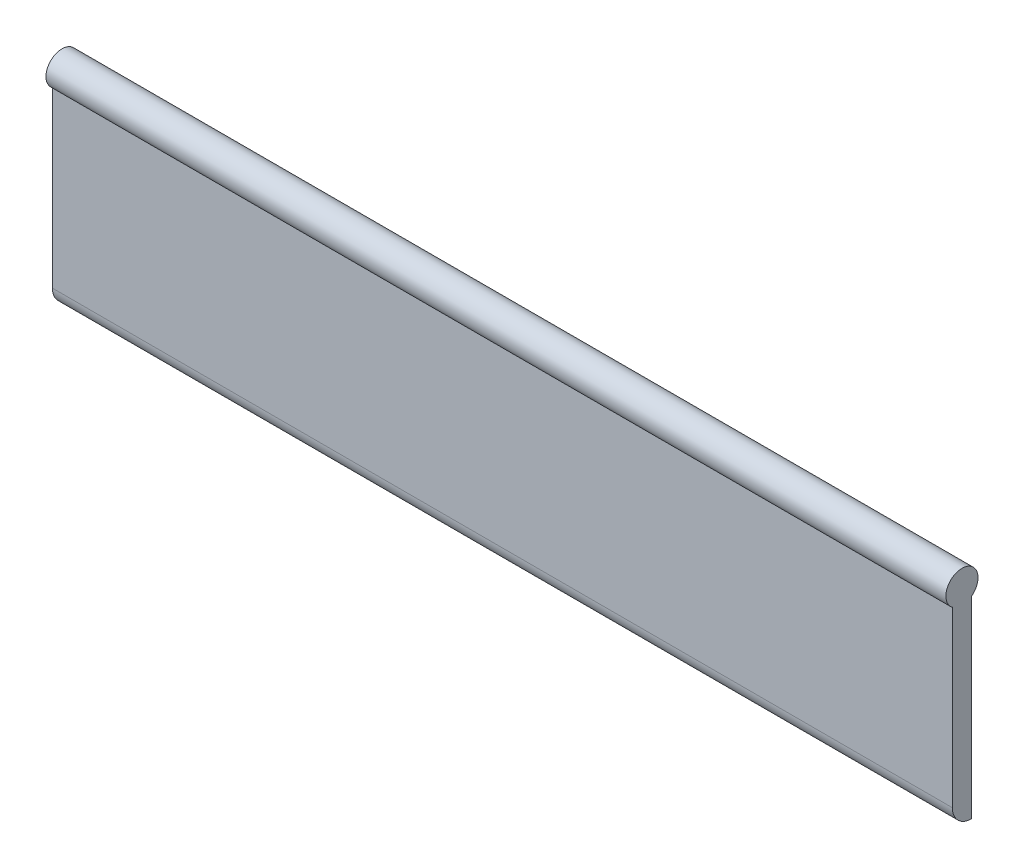
from build123d import *

# Parameters (mm, degrees)
BOSS_EXTRUDE1_DEPTH = 140


with BuildPart() as part:
    # Sketch1 → Boss-Extrude1 (new body)
    with BuildSketch(Plane(origin=(0, 0, 0), x_dir=(0, 0, -1), z_dir=(1, 0, 0))):
        with BuildLine():
            ThreePointArc((0, 3), (0.878679656, 0.878679656), (3, 0))
            Line((3, 0), (3, 30))
            ThreePointArc((3, 30), (1.5, 34.5), (0, 30))
            Line((0, 30), (0, 3))
        make_face()
    extrude(amount=BOSS_EXTRUDE1_DEPTH)


solid = part.part
